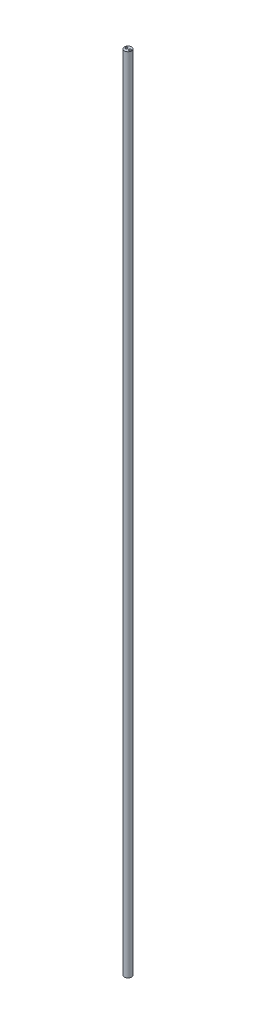
from build123d import *

# Parameters (mm, degrees)
BODY_EXTRUDE_DEPTH = 20


with BuildPart() as part:
    # CROSS SECTION → Body Extrude (new body)
    with BuildSketch(Plane(origin=(0, 0, 0), x_dir=(1, 0, 0), z_dir=(0, 1, 0))):
        with BuildLine():
            ThreePointArc((0.01785, 0), (0.04685, 0.029), (0.07585, 0))
            Line((0.07585, 0), (0.088, 0))
            ThreePointArc((0.088, 0), (0, 0.088), (-0.088, 0))
            Line((-0.088, 0), (-0.0655, 0))
            ThreePointArc((-0.0655, 0), (-0.0367, 0.0288), (-0.0079, 0))
            Line((-0.0079, 0), (-0.00556, 0))
            add(Edge.make_bspline(
                [(-0.00025, 0), (-0.00025, 0.00366), (-0.002905, 0.00366), (-0.00556, 0.00366), (-0.00556, 0)],
                knots=[1.570796327, 1.570796327, 1.570796327, 3.141592654, 3.141592654, 4.71238898, 4.71238898, 4.71238898], degree=2, weights=[1, 0.707106781, 1, 0.707106781, 1]))
            Line((-0.00025, 0), (0.01785, 0))
        make_face()
        with BuildLine():
            Line((0.088, 0), (0.07585, 0))
            ThreePointArc((0.07585, 0), (0.04685, -0.029), (0.01785, 0))
            Line((0.01785, 0), (-0.00025, 0))
            add(Edge.make_bspline(
                [(-0.002905, -0.00366), (-0.00025, -0.00366), (-0.00025, 0)],
                knots=[0, 0, 0, 1.570796327, 1.570796327, 1.570796327], degree=2, weights=[1, 0.707106781, 1]))
            add(Edge.make_bspline(
                [(-0.00556, 0), (-0.00556, -0.00366), (-0.002905, -0.00366)],
                knots=[4.71238898, 4.71238898, 4.71238898, 6.283185307, 6.283185307, 6.283185307], degree=2, weights=[1, 0.707106781, 1]))
            Line((-0.00556, 0), (-0.0079, 0))
            ThreePointArc((-0.0079, 0), (-0.0367, -0.0288), (-0.0655, 0))
            Line((-0.0655, 0), (-0.088, 0))
            ThreePointArc((-0.088, 0), (0, -0.088), (0.088, 0))
        make_face()
        with BuildLine():
            add(Edge.make_bspline(
                [(-0.002905, -0.00366), (-0.00025, -0.00366), (-0.00025, 0)],
                knots=[0, 0, 0, 1.570796327, 1.570796327, 1.570796327], degree=2, weights=[1, 0.707106781, 1]))
            Line((-0.00025, 0), (-0.00556, 0))
            add(Edge.make_bspline(
                [(-0.00556, 0), (-0.00556, -0.00366), (-0.002905, -0.00366)],
                knots=[4.71238898, 4.71238898, 4.71238898, 6.283185307, 6.283185307, 6.283185307], degree=2, weights=[1, 0.707106781, 1]))
        make_face()
        with BuildLine():
            Line((-0.00556, 0), (-0.00025, 0))
            add(Edge.make_bspline(
                [(-0.00025, 0), (-0.00025, 0.00366), (-0.002905, 0.00366), (-0.00556, 0.00366), (-0.00556, 0)],
                knots=[1.570796327, 1.570796327, 1.570796327, 3.141592654, 3.141592654, 4.71238898, 4.71238898, 4.71238898], degree=2, weights=[1, 0.707106781, 1, 0.707106781, 1]))
        make_face()
    extrude(amount=BODY_EXTRUDE_DEPTH)


solid = part.part
